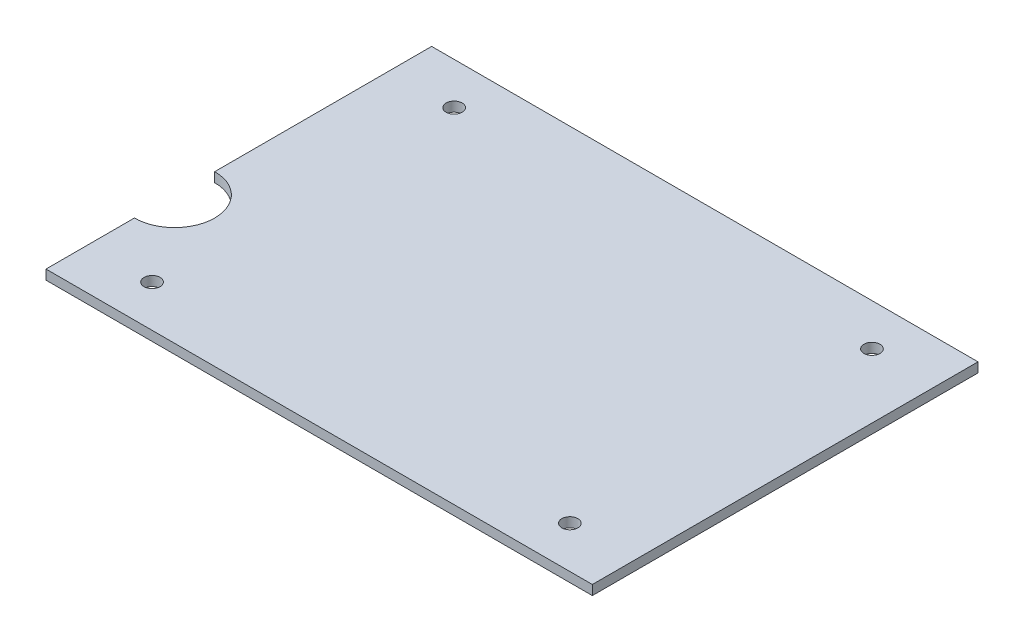
from build123d import *

# Parameters (mm, degrees)
SKETCH1_W           = 170
SKETCH1_H           = 120
SKETCH1_R           = 2.5
BOSS_EXTRUDE1_DEPTH = 3
CUT_EXTRUDE1_REACH  = 106.087
SKETCH2_R           = 12.5


with BuildPart() as part:
    # Sketch1 → Boss-Extrude1 (new body)
    with BuildSketch(Plane(origin=(0, 0, 0), x_dir=(1, 0, 0), z_dir=(0, 1, 0))):
        Rectangle(SKETCH1_W, SKETCH1_H)
        with Locations(Location((-65, 47, 0), (0, 0, 270))):
            Circle(SKETCH1_R, mode=Mode.SUBTRACT)
        with Locations(Location((-65, -47, 0), (0, 0, 90))):
            Circle(SKETCH1_R, mode=Mode.SUBTRACT)
        with Locations(Location((65, -47, 0), (0, 0, 270))):
            Circle(SKETCH1_R, mode=Mode.SUBTRACT)
        with Locations(Location((65, 47, 0), (0, 0, 90))):
            Circle(SKETCH1_R, mode=Mode.SUBTRACT)
    extrude(amount=BOSS_EXTRUDE1_DEPTH)

    # Sketch2 → Cut-Extrude1 (cut, up to next)
    with BuildSketch(Plane(origin=(0, 3, 0), x_dir=(1, 0, 0), z_dir=(0, 1, 0)), mode=Mode.PRIVATE) as cut_extrude1_sk1:
        with Locations((-85, -20)):
            Circle(SKETCH2_R)
    cut_extrude1_tool1 = extrude(cut_extrude1_sk1.sketch, amount=-CUT_EXTRUDE1_REACH, mode=Mode.PRIVATE) & part.part
    add(cut_extrude1_tool1.solids().sort_by_distance((-85, 3, 20))[0], mode=Mode.SUBTRACT)


solid = part.part
